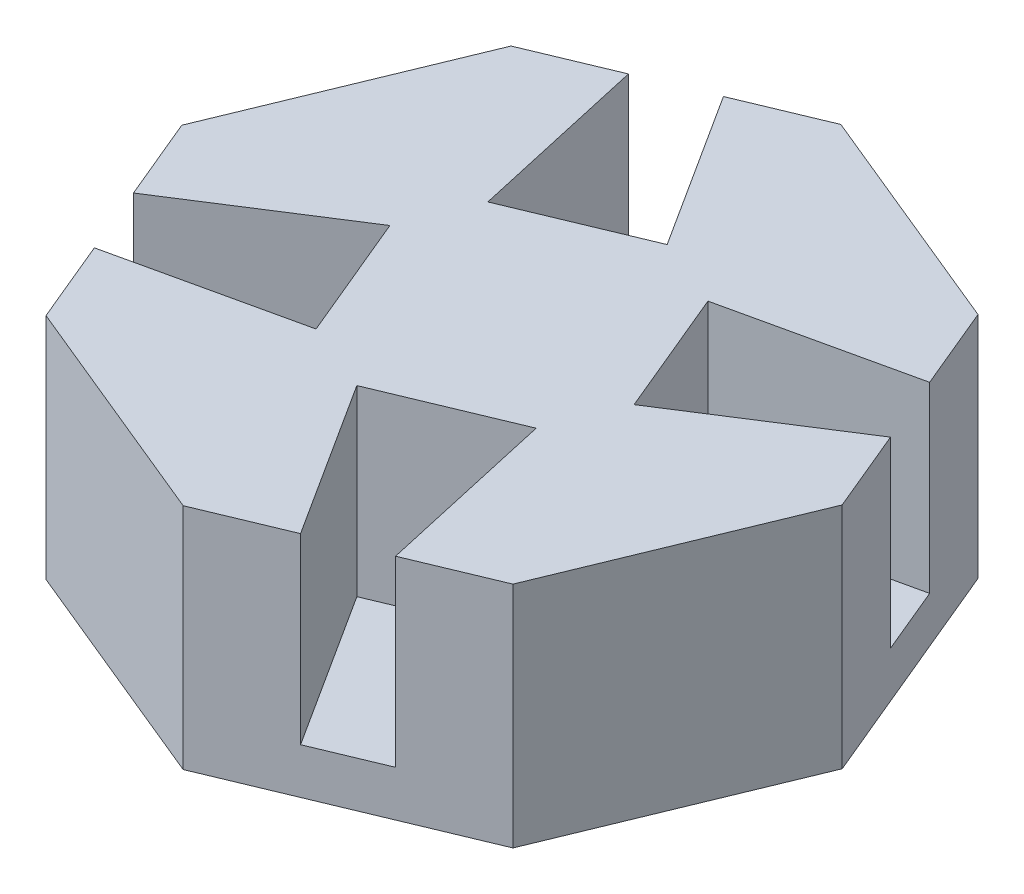
from build123d import *

# Parameters (mm, degrees)
BOSS_EXTRUDE1_DEPTH = 38.1
CUT_EXTRUDE1_DEPTH  = 30.48


with BuildPart() as part:
    # Sketch1 → Boss-Extrude1 (new body)
    with BuildSketch(Plane(origin=(0, 0, 0), x_dir=(1, 0, 0), z_dir=(0, 1, 0))):
        Polygon((-0.111992667, 54.937923296), (-38.926168882, 38.767787333), (-54.937923296, -0.111992667), (-38.767787333, -38.926168882), (0.111992667, -54.937923296), (38.926168882, -38.767787333), (54.937923296, 0.111992667), (38.767787333, 38.926168882), align=None)
    extrude(amount=BOSS_EXTRUDE1_DEPTH)

    # Sketch2 → Cut-Extrude1 (cut)
    with BuildSketch(Plane(origin=(0, 38.1, 0), x_dir=(1, 0, 0), z_dir=(0, 1, 0))):
        Polygon((18.348513836, -14.32125417), (-2.753495069, -23.112432713), (13.929214345, -49.181615294), (25.108947204, -44.524095336), align=None)
        Polygon((-14.32125417, -18.348513836), (-23.112432713, 2.753495069), (-49.181615294, -13.929214345), (-44.524095336, -25.108947204), align=None)
        Polygon((-18.348513836, 14.32125417), (2.753495069, 23.112432713), (-13.929214345, 49.181615294), (-25.108947204, 44.524095336), align=None)
        Polygon((14.32125417, 18.348513836), (23.112432713, -2.753495069), (49.181615294, 13.929214345), (44.524095336, 25.108947204), align=None)
    extrude(amount=-CUT_EXTRUDE1_DEPTH, mode=Mode.SUBTRACT)


solid = part.part
